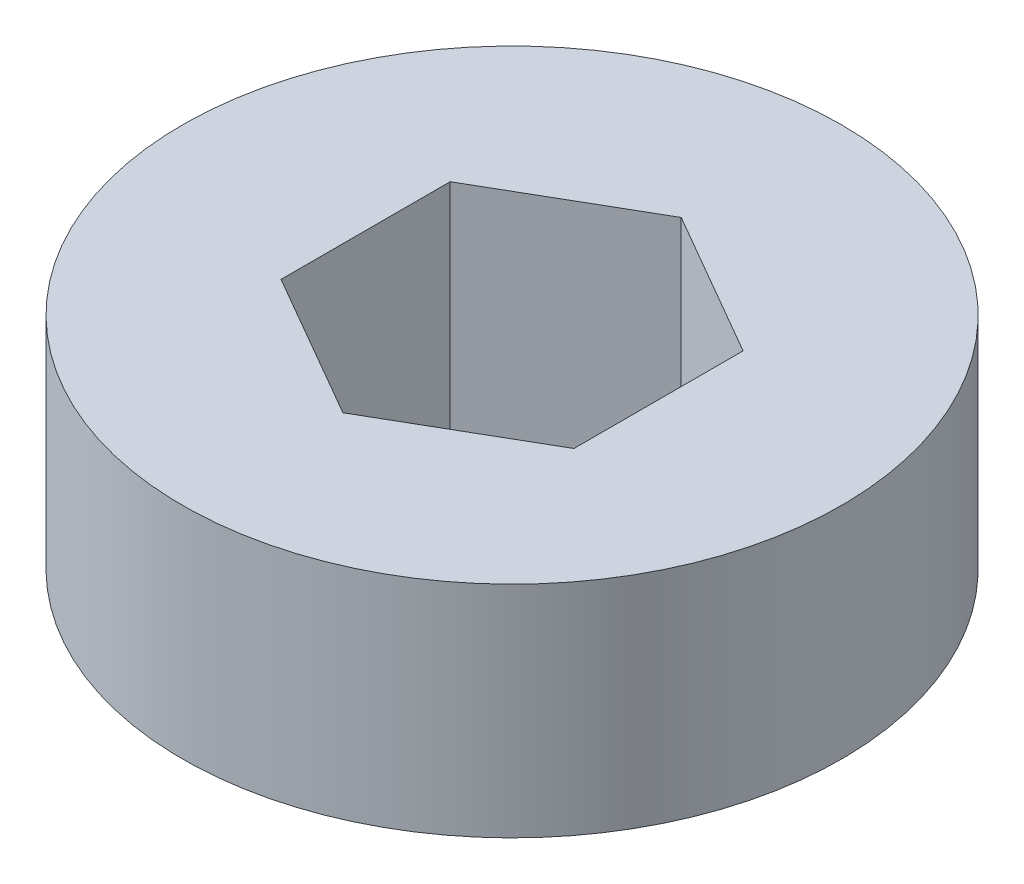
from build123d import *

# Parameters (mm, degrees)
SKETCH1_R           = 14.2875
BOSS_EXTRUDE1_DEPTH = 9.525


with BuildPart() as part:
    # Sketch1 → Boss-Extrude1 (new body)
    with BuildSketch(Plane(origin=(0, 0, 0), x_dir=(1, 0, 0), z_dir=(0, 1, 0))):
        with Locations(Location((0, 0, 0), (0, 0, 90))):
            Circle(SKETCH1_R)
        Polygon((6.35, -3.666174209), (6.35, 3.666174209), (0, 7.332348419), (-6.35, 3.666174209), (-6.35, -3.666174209), (0, -7.332348419), align=None, mode=Mode.SUBTRACT)
    extrude(amount=BOSS_EXTRUDE1_DEPTH)


solid = part.part
